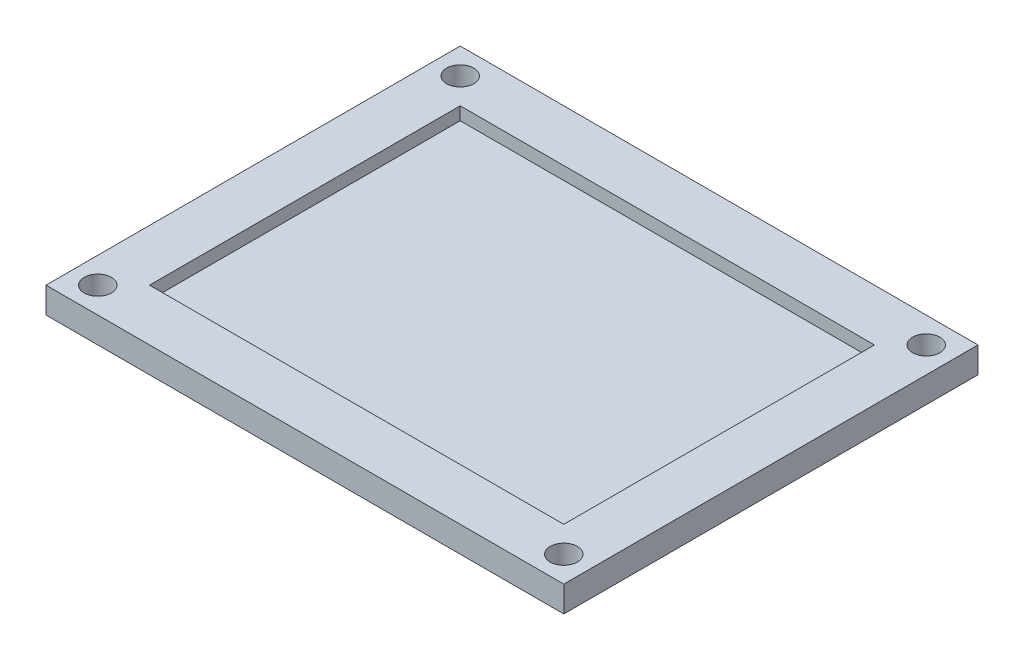
from build123d import *

# Parameters (mm, degrees)
SKETCH1_W           = 200
SKETCH1_H           = 160
BOSS_EXTRUDE3_DEPTH = 10
SKETCH3_R           = 5.25
SKETCH3_W           = 160
SKETCH3_H           = 120
CUT_EXTRUDE2_DEPTH  = 5
SKETCH6_R           = 5.25
CUT_EXTRUDE4_DEPTH  = 129.16005618


with BuildPart() as part:
    # Sketch1 → Boss-Extrude3 (new body)
    with BuildSketch(Plane(origin=(0, 0, 0), x_dir=(1, 0, 0), z_dir=(0, 1, 0))):
        Rectangle(SKETCH1_W, SKETCH1_H)
    extrude(amount=BOSS_EXTRUDE3_DEPTH)

    # Sketch3 → Cut-Extrude2 (cut)
    with BuildSketch(Plane(origin=(0, 10, 0), x_dir=(1, 0, 0), z_dir=(0, 1, 0))):
        with Locations(Location((-90, 70, 0), (0, 0, 270))):
            Circle(SKETCH3_R)
        with Locations(Location((90, -70, 0), (0, 0, 270))):
            Circle(SKETCH3_R)
        with Locations(Location((90, 70, 0), (0, 0, 270))):
            Circle(SKETCH3_R)
        with Locations(Location((-90, -70, 0), (0, 0, 270))):
            Circle(SKETCH3_R)
        Rectangle(SKETCH3_W, SKETCH3_H)
    extrude(amount=-CUT_EXTRUDE2_DEPTH, mode=Mode.SUBTRACT)

    # Sketch6 → Cut-Extrude4 (cut, through all)
    with BuildSketch(Plane(origin=(0, 5, 0), x_dir=(1, 0, 0), z_dir=(0, 1, 0))):
        with Locations(Location((-90, 70, 0), (0, 0, 270))):
            Circle(SKETCH6_R)
        with Locations(Location((90, 70, 0), (0, 0, 270))):
            Circle(SKETCH6_R)
        with Locations(Location((90, -70, 0), (0, 0, 270))):
            Circle(SKETCH6_R)
        with Locations(Location((-90, -70, 0), (0, 0, 270))):
            Circle(SKETCH6_R)
    extrude(amount=-CUT_EXTRUDE4_DEPTH, mode=Mode.SUBTRACT)


solid = part.part
